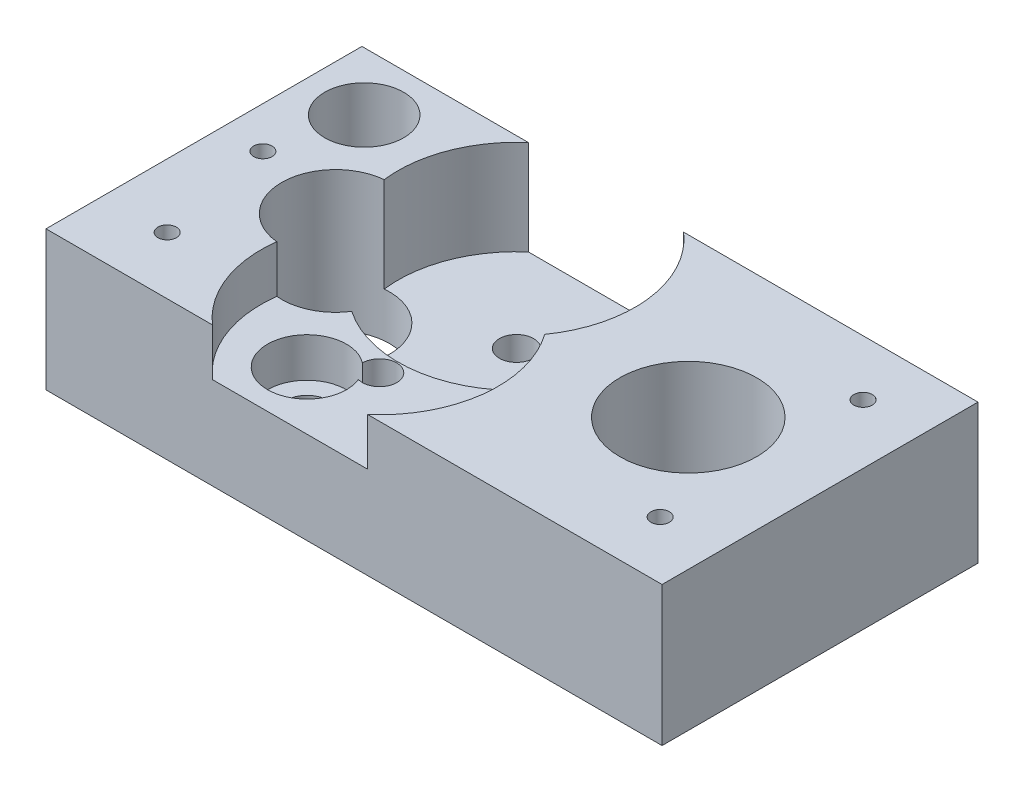
from build123d import *

# Parameters (mm, degrees)
SKETCH_1_W          = 23.4
SKETCH_1_H          = 12
SKETCH_1_R          = 2.05
SKETCH_1_R_2        = 0.65
SKETCH_1_R_3        = 2.6
EXTRUDE_1_DEPTH     = 1.7
SKETCH_3_R          = 0.65
SKETCH_3_R_2        = 2.6
EXTRUDE_3_DEPTH     = 1.8
EXTRUDE_START       = 1.8
SKETCH_3_16_R       = 2.6
EXTRUDE_4_DEPTH     = 1.8
CUT_EXTRUDE_START   = 5.3
SKETCH_5_R          = 0.8
CUT_EXTRUDE_1_DEPTH = 33.126293072
SKETCH_5_10_R       = 1.5
CUT_EXTRUDE_3_DEPTH = 3.3
SKETCH_7_R          = 0.35
CUT_EXTRUDE_4_DEPTH = 2


with BuildPart() as part:
    # 草图1 → 凸台-拉伸1 (new body)
    with BuildSketch(Plane(origin=(0, 0, 0), x_dir=(1, 0, 0), z_dir=(0, 1, 0))):
        with Locations((11.7, -6)):
            Rectangle(SKETCH_1_W, SKETCH_1_H)
        with Locations(Location((5, -6, 0), (0, 0, 270))):
            Circle(SKETCH_1_R, mode=Mode.SUBTRACT)
        with Locations(Location((9.270831301, -8.6, 0), (0, 0, 270))):
            Circle(SKETCH_1_R_2, mode=Mode.SUBTRACT)
        with Locations(Location((18.395740059, -6, 0), (0, 0, 270))):
            Circle(SKETCH_1_R_3, mode=Mode.SUBTRACT)
        with Locations(Location((9.270831301, -3.4, 0), (0, 0, 270))):
            Circle(SKETCH_1_R_2, mode=Mode.SUBTRACT)
    extrude(amount=EXTRUDE_1_DEPTH)

    # 草图3 → 凸台-拉伸3 (add)
    with BuildSketch(Plane(origin=(0, 1.7, 0), x_dir=(1, 0, 0), z_dir=(0, 1, 0))):
        with BuildLine():
            Line((6.322950706, 0), (0, 0))
            Line((0, 0), (0, -12))
            Line((0, -12), (23.4, -12))
            Line((23.4, -12), (23.4, 0))
            Line((23.4, 0), (12.218711895, 0))
            ThreePointArc((12.218711895, 0), (12.831329536, -6.151881595), (6.723669831, -7.109712717))
            ThreePointArc((6.723669831, -7.109712717), (3.248959167, -7.066), (4.805714858, -3.959227283))
            ThreePointArc((4.805714858, -3.959227283), (5.068807808, -1.789720968), (6.322950706, 0))
        make_face()
        with Locations(Location((9.270831301, -8.6, 0), (0, 0, 270))):
            Circle(SKETCH_3_R, mode=Mode.SUBTRACT)
        with Locations(Location((18.395740059, -6, 0), (0, 0, 270))):
            Circle(SKETCH_3_R_2, mode=Mode.SUBTRACT)
    extrude(amount=EXTRUDE_3_DEPTH)

    # 草图3<16> → 凸台-拉伸4 (add)
    # profile 1 of 2: a face of its own
    with BuildSketch(Plane(origin=(0, 1.7, 0), x_dir=(1, 0, 0), z_dir=(0, 1, 0)).offset(EXTRUDE_START)):
        with BuildLine():
            Line((6.322950706, 0), (0, 0))
            Line((0, 0), (0, -12))
            Line((0, -12), (6.322950706, -12))
            ThreePointArc((6.322950706, -12), (5.068807808, -10.210279032), (4.805714858, -8.040772717))
            ThreePointArc((4.805714858, -8.040772717), (2.95, -6), (4.805714858, -3.959227283))
            ThreePointArc((4.805714858, -3.959227283), (5.068807808, -1.789720968), (6.322950706, 0))
        make_face()
    # profile 2 of 2: a face of its own
    with BuildSketch(Plane(origin=(0, 1.7, 0), x_dir=(1, 0, 0), z_dir=(0, 1, 0)).offset(EXTRUDE_START)):
        with BuildLine():
            Line((23.4, 0), (12.218711895, 0))
            ThreePointArc((12.218711895, 0), (13.364452111, -1.531238736), (13.770831301, -3.4))
            ThreePointArc((13.770831301, -3.4), (13.559067005, -4.7641974), (12.943704835, -6))
            ThreePointArc((12.943704835, -6), (13.559067005, -7.2358026), (13.770831301, -8.6))
            ThreePointArc((13.770831301, -8.6), (13.364452111, -10.468761264), (12.218711895, -12))
            Line((12.218711895, -12), (23.4, -12))
            Line((23.4, -12), (23.4, 0))
        make_face()
        with Locations(Location((18.395740059, -6, 0), (0, 0, 270))):
            Circle(SKETCH_3_16_R, mode=Mode.SUBTRACT)
    extrude(amount=EXTRUDE_4_DEPTH)

    # 草图5 → 切除-拉伸1 (cut, through all)
    with BuildSketch(Plane(origin=(0, 0, 0), x_dir=(1, 0, 0), z_dir=(0, 1, 0)).offset(CUT_EXTRUDE_START)):
        with Locations(Location((2.3, -2.214171161, 0), (0, 0, 270))):
            Circle(SKETCH_5_R)
        with Locations(Location((7.7, -9.785828839, 0), (0, 0, 270))):
            Circle(SKETCH_5_R)
    extrude(amount=-CUT_EXTRUDE_1_DEPTH, mode=Mode.SUBTRACT)

    # 草图5<10> → 切除-拉伸3 (cut)
    with BuildSketch(Plane(origin=(0, 0, 0), x_dir=(1, 0, 0), z_dir=(0, 1, 0)).offset(CUT_EXTRUDE_START)):
        with Locations(Location((2.3, -2.214171161, 0), (0, 0, 270))):
            Circle(SKETCH_5_10_R)
        with Locations((7.7, -9.785828839)):
            Circle(SKETCH_5_10_R)
    extrude(amount=-CUT_EXTRUDE_3_DEPTH, mode=Mode.SUBTRACT)

    # 草图7 → 切除-拉伸4 (cut)
    with BuildSketch(Plane(origin=(0, 5.3, 0), x_dir=(1, 0, 0), z_dir=(0, 1, 0))):
        with Locations(Location((1.568943185, -5.332489754, 0), (0, 0, 270))):
            Circle(SKETCH_7_R)
        with Locations(Location((2.419185522, -9.817518082, 0), (0, 0, 270))):
            Circle(SKETCH_7_R)
        with Locations(Location((21.143175994, -2.108925173, 0), (0, 0, 270))):
            Circle(SKETCH_7_R)
        with Locations(Location((21.143175994, -9.817518082, 0), (0, 0, 270))):
            Circle(SKETCH_7_R)
    extrude(amount=-CUT_EXTRUDE_4_DEPTH, mode=Mode.SUBTRACT)


solid = part.part
